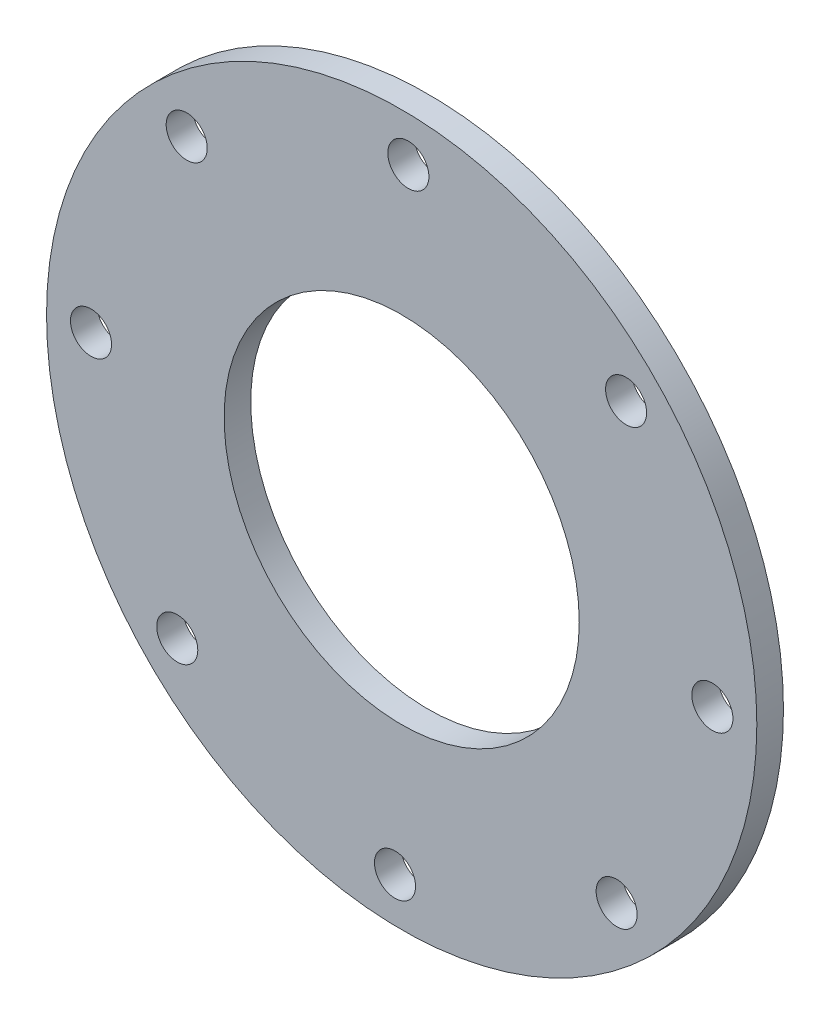
from build123d import *

# Parameters (mm, degrees)
SKETCH1_R           = 160
SKETCH1_R_2         = 80
SKETCH1_R_3         = 9.25
BOSS_EXTRUDE1_DEPTH = 6


with BuildPart() as part:
    # Sketch1 → Boss-Extrude1 (new, symmetric)
    with BuildSketch(Plane.XY):
        Circle(SKETCH1_R)
        Circle(SKETCH1_R_2, mode=Mode.SUBTRACT)
        with Locations((-96.844081606, 101.100068535)):
            Circle(SKETCH1_R_3, mode=Mode.SUBTRACT)
        with Locations((3.009437218, 139.967650861)):
            Circle(SKETCH1_R_3, mode=Mode.SUBTRACT)
        with Locations((101.100068535, 96.844081606)):
            Circle(SKETCH1_R_3, mode=Mode.SUBTRACT)
        with Locations((139.967650861, -3.009437218)):
            Circle(SKETCH1_R_3, mode=Mode.SUBTRACT)
        with Locations((96.844081606, -101.100068535)):
            Circle(SKETCH1_R_3, mode=Mode.SUBTRACT)
        with Locations((-3.009437218, -139.967650861)):
            Circle(SKETCH1_R_3, mode=Mode.SUBTRACT)
        with Locations((-101.100068535, -96.844081606)):
            Circle(SKETCH1_R_3, mode=Mode.SUBTRACT)
        with Locations((-139.967650861, 3.009437218)):
            Circle(SKETCH1_R_3, mode=Mode.SUBTRACT)
    extrude(amount=BOSS_EXTRUDE1_DEPTH, both=True)


solid = part.part
